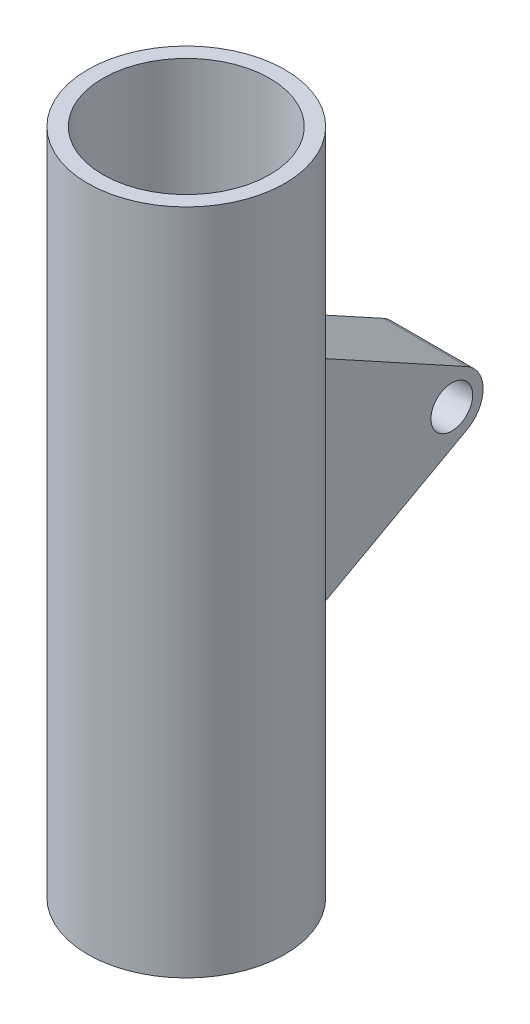
from build123d import *

# Parameters (mm, degrees)
SKETCH1_R                            = 30
SKETCH1_R_2                          = 25.4
BOSS_EXTRUDE1_DEPTH                  = 203.2
SKETCH2_W                            = 25.4
SKETCH2_H                            = 63.5
BOSS_EXTRUDE2_DEPTH                  = 50.8
BOSS_EXTRUDE2_DIRECTION_2_REACH      = 215.987
BOSS_EXTRUDE2_DIRECTION_2_END_RADIUS = 30
CUT_EXTRUDE3_REACH                   = 224.805
SKETCH3_R                            = 6.35
CUT_EXTRUDE3_DIRECTION_2_DEPTH       = 223.805228843


with BuildPart() as part:
    # Sketch1 → Boss-Extrude1 (new body)
    with BuildSketch(Plane(origin=(0, 0, 0), x_dir=(1, 0, 0), z_dir=(0, 1, 0))):
        with Locations(Location((0, 0, 0), (0, 0, 270))):
            Circle(SKETCH1_R)
        with Locations(Location((0, 0, 0), (0, 0, 270))):
            Circle(SKETCH1_R_2, mode=Mode.SUBTRACT)
    extrude(amount=BOSS_EXTRUDE1_DEPTH)

    # Sketch2 → Boss-Extrude2 (add)
    with BuildSketch(Plane(origin=(0, 0, -30), x_dir=(-1, 0, 0), z_dir=(0, 0, -1))):
        with Locations((0, 101.6)):
            Rectangle(SKETCH2_W, SKETCH2_H)
    extrude(amount=BOSS_EXTRUDE2_DEPTH)

    # Boss-Extrude2 direction 2: up to this cylinder (the profile starts outside it)
    boss_extrude2_direction_2_end = Plane(origin=(0, 101.6, 0), z_dir=(0, -1, 0)) * Cylinder(BOSS_EXTRUDE2_DIRECTION_2_END_RADIUS, 492.974, mode=Mode.PRIVATE)
    # Sketch2 → Boss-Extrude2 direction 2 (add, up to the surface)
    with BuildSketch(Plane(origin=(0, 0, -30), x_dir=(-1, 0, 0), z_dir=(0, 0, -1)), mode=Mode.PRIVATE) as boss_extrude2_direction_2_sk1:
        with Locations((0, 101.6)):
            Rectangle(SKETCH2_W, SKETCH2_H)
    boss_extrude2_direction_2_tool1 = extrude(boss_extrude2_direction_2_sk1.sketch, amount=-BOSS_EXTRUDE2_DIRECTION_2_REACH, mode=Mode.PRIVATE) - boss_extrude2_direction_2_end
    add(boss_extrude2_direction_2_tool1.solids().sort_by_distance((0, 101.6, -30))[0])
    add(boss_extrude2_direction_2_tool1.solids().sort_by_distance((0, 101.6, -30))[1])

    # Sketch3 → Cut-Extrude3 (cut, up to next)
    with BuildSketch(Plane(origin=(12.7, 0, 0), x_dir=(0, 0, -1), z_dir=(1, 0, 0)), mode=Mode.PRIVATE) as cut_extrude3_sk1:
        with BuildLine():
            Line((72.678913322, 93.247804014), (30, 69.85))
            Line((30, 69.85), (80.8, 69.85))
            Line((80.8, 69.85), (80.8, 133.35))
            Line((80.8, 133.35), (30, 133.35))
            Line((30, 133.35), (72.678913322, 109.952195986))
            ThreePointArc((72.678913322, 109.952195986), (76.295723714, 106.453425368), (77.625, 101.6))
            ThreePointArc((77.625, 101.6), (76.295723714, 96.746574632), (72.678913322, 93.247804014))
        make_face()
    cut_extrude3_tool1 = extrude(cut_extrude3_sk1.sketch, amount=-CUT_EXTRUDE3_REACH, mode=Mode.PRIVATE) & part.part
    # Sketch3 → Cut-Extrude3 (cut, up to next)
    with BuildSketch(Plane(origin=(12.7, 0, 0), x_dir=(0, 0, -1), z_dir=(1, 0, 0)), mode=Mode.PRIVATE) as cut_extrude3_sk2:
        with Locations(Location((68.1, 101.6, 0), (0, 0, 270))):
            Circle(SKETCH3_R)
    cut_extrude3_tool2 = extrude(cut_extrude3_sk2.sketch, amount=-CUT_EXTRUDE3_REACH, mode=Mode.PRIVATE) & part.part
    add(cut_extrude3_tool1.solids().sort_by_distance((12.7, 80.835833, -51.730381))[0], mode=Mode.SUBTRACT)
    add(cut_extrude3_tool2.solids().sort_by_distance((12.7, 101.6, -68.1))[0], mode=Mode.SUBTRACT)

    # Sketch3 → Cut-Extrude3 direction 2 (cut)
    with BuildSketch(Plane(origin=(12.7, 0, 0), x_dir=(0, 0, -1), z_dir=(1, 0, 0))):
        with BuildLine():
            Line((72.678913322, 93.247804014), (30, 69.85))
            Line((30, 69.85), (80.8, 69.85))
            Line((80.8, 69.85), (80.8, 133.35))
            Line((80.8, 133.35), (30, 133.35))
            Line((30, 133.35), (72.678913322, 109.952195986))
            ThreePointArc((72.678913322, 109.952195986), (76.295723714, 106.453425368), (77.625, 101.6))
            ThreePointArc((77.625, 101.6), (76.295723714, 96.746574632), (72.678913322, 93.247804014))
        make_face()
        with Locations(Location((68.1, 101.6, 0), (0, 0, 270))):
            Circle(SKETCH3_R)
    extrude(amount=CUT_EXTRUDE3_DIRECTION_2_DEPTH, mode=Mode.SUBTRACT)


solid = part.part
